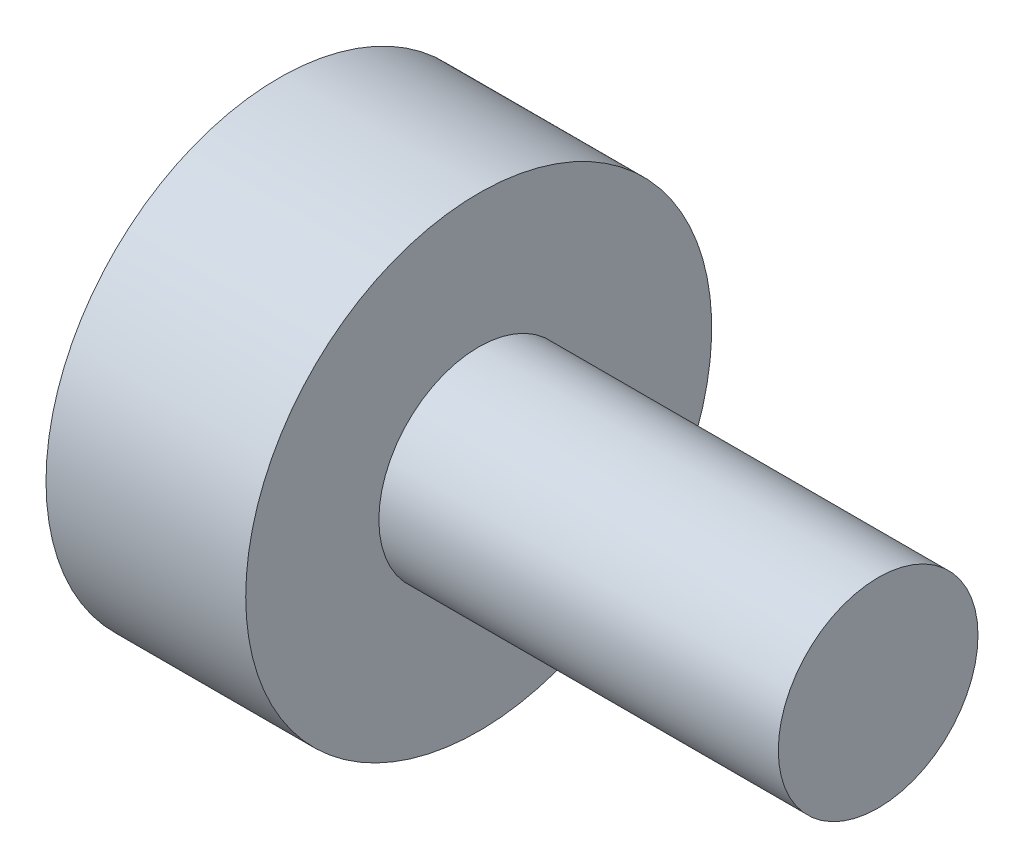
from build123d import *

# Parameters (mm, degrees)
SKETCH_2_R          = 5
CUT_EXTRUDE_1_DEPTH = 20


with BuildPart() as part:
    # Эскиз1 → Повернуть1 (revolve)
    with BuildSketch(Plane.XY, mode=Mode.PRIVATE) as revolve_1_sk:
        Polygon((0, 0), (100, 0), (100, 15), (40, 15), (40, 35), (10, 35), (10, 20), (0, 20), align=None)
    revolve(revolve_1_sk.sketch.rotate(Axis((0, 0, 0), (1, 0, 0)), 90), axis=Axis((0, 0, 0), (1, 0, 0)))

    # Эскиз2 → Вырез-Вытянуть1 (cut)
    with BuildSketch(Plane.XY):
        Circle(SKETCH_2_R)
    extrude(amount=-CUT_EXTRUDE_1_DEPTH, mode=Mode.SUBTRACT)


solid = part.part
